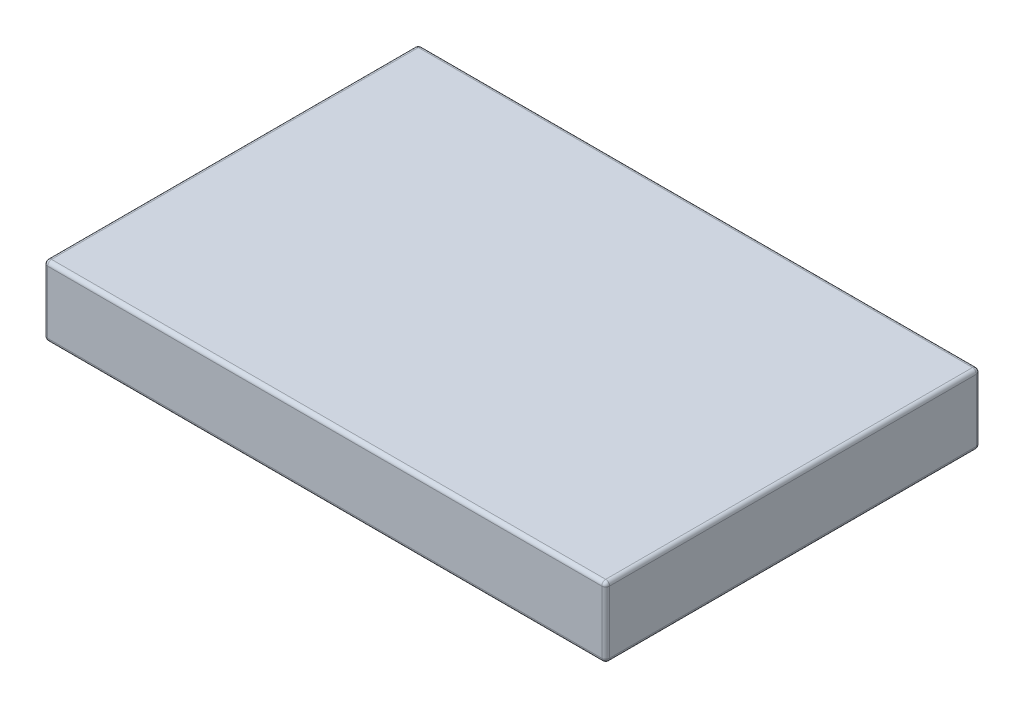
from build123d import *

# Parameters (mm, degrees)
SKETCH1_W           = 3657.6
SKETCH1_H           = 2438.4
BOSS_EXTRUDE1_DEPTH = 457.2
FILLET1_R           = 25.4


with BuildPart() as part:
    # Sketch1 → Boss-Extrude1 (new body)
    with BuildSketch(Plane(origin=(0, 0, 0), x_dir=(1, 0, 0), z_dir=(0, 1, 0))):
        Rectangle(SKETCH1_W, SKETCH1_H)
    extrude(amount=BOSS_EXTRUDE1_DEPTH)

    # Fillet1
    fillet1_edges = [part.edges().sort_by_distance(p)[0] for p in [
        (-1828.8, 457.2, 0),
        (0, 457.2, 1219.2),
        (1828.8, 457.2, 0),
        (0, 0, 1219.2),
        (-1828.8, 0, 0),
        (0, 0, -1219.2),
        (1828.8, 0, 0),
        (0, 457.2, -1219.2),
        (1828.8, 228.6, 1219.2),
        (-1828.8, 228.6, 1219.2),
        (-1828.8, 228.6, -1219.2),
        (1828.8, 228.6, -1219.2),
    ]]
    fillet(fillet1_edges, radius=FILLET1_R)


solid = part.part
